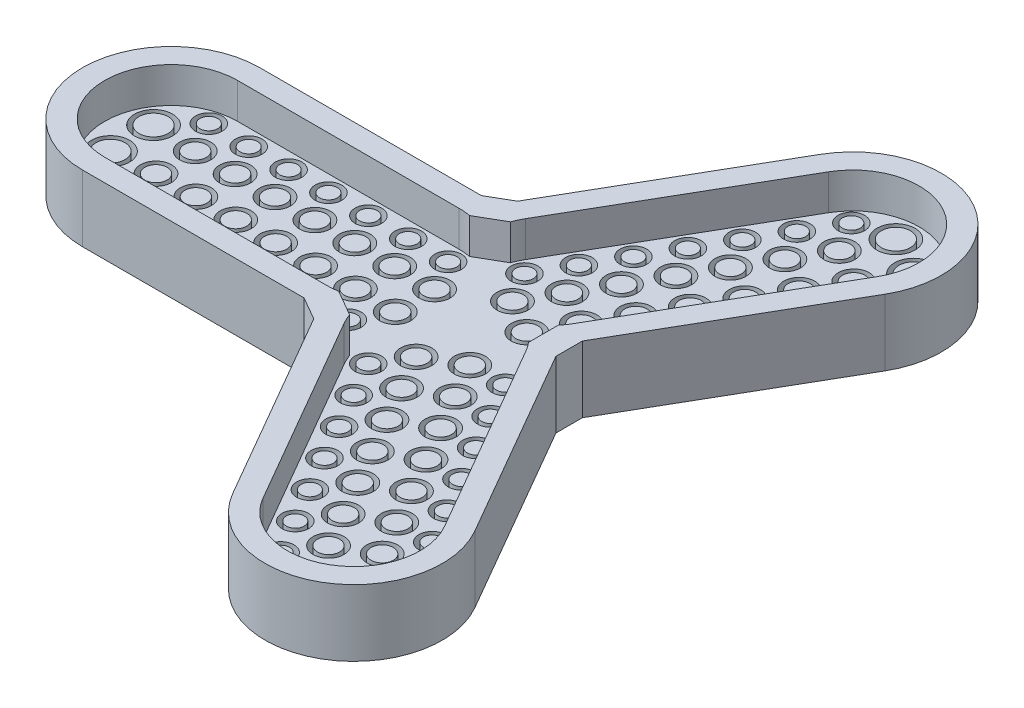
from build123d import *

# Parameters (mm, degrees)
BOSS_EXTRUDE1_DEPTH = 15
BOSS_EXTRUDE2_DEPTH = 7
SKETCH2_R           = 3.5
SKETCH2_R_2         = 2.5
SKETCH2_R_3         = 3
SKETCH2_R_4         = 2
SKETCH2_R_5         = 4.287290874
SKETCH2_R_6         = 3.287290874
CUT_EXTRUDE1_DEPTH  = 4


with BuildPart() as part:
    # Sketch1 → Boss-Extrude1 (new body)
    with BuildSketch(Plane(origin=(0, 0, 0), x_dir=(1, 0, 0), z_dir=(0, 1, 0))):
        with BuildLine():
            Line((-25, -20), (25, -20))
            Line((25, -20), (30.179491924, -22.990381057))
            Line((30.179491924, -22.990381057), (55.179491924, -66.291651246))
            ThreePointArc((55.179491924, -66.291651246), (82.5, -73.612159322), (89.820508076, -46.291651246))
            Line((89.820508076, -46.291651246), (64.820508076, -2.990381057))
            Line((64.820508076, -2.990381057), (64.820508076, 2.990381057))
            Line((64.820508076, 2.990381057), (89.820508076, 46.291651246))
            ThreePointArc((89.820508076, 46.291651246), (82.5, 73.612159322), (55.179491924, 66.291651246))
            Line((55.179491924, 66.291651246), (30.179491924, 22.990381057))
            Line((30.179491924, 22.990381057), (25, 20))
            Line((25, 20), (-25, 20))
            ThreePointArc((-25, 20), (-45, 0), (-25, -20))
        make_face()
        with BuildLine():
            ThreePointArc((-25, -15), (-40, 0), (-25, 15))
            Line((-25, 15), (25, 15))
            ThreePointArc((25, 15), (26.294788991, 14.944012897), (27.579912451, 14.776469529))
            Line((27.579912451, 14.776469529), (33.413245784, 18.144346099))
            ThreePointArc((33.413245784, 18.144346099), (33.910710701, 19.341067347), (34.509618943, 20.490381057))
            Line((34.509618943, 20.490381057), (59.509618943, 63.791651246))
            ThreePointArc((59.509618943, 63.791651246), (80, 69.282032303), (85.490381057, 48.791651246))
            Line((85.490381057, 48.791651246), (60.490381057, 5.490381057))
            ThreePointArc((60.490381057, 5.490381057), (59.794500308, 4.397054449), (59.006841765, 3.36787657))
            Line((59.006841765, 3.36787657), (59.006841765, -3.36787657))
            ThreePointArc((59.006841765, -3.36787657), (59.794500308, -4.397054449), (60.490381057, -5.490381057))
            Line((60.490381057, -5.490381057), (85.490381057, -48.791651246))
            ThreePointArc((85.490381057, -48.791651246), (80, -69.282032303), (59.509618943, -63.791651246))
            Line((59.509618943, -63.791651246), (34.509618943, -20.490381057))
            ThreePointArc((34.509618943, -20.490381057), (33.910710701, -19.341067347), (33.413245784, -18.144346099))
            Line((33.413245784, -18.144346099), (27.579912451, -14.776469529))
            ThreePointArc((27.579912451, -14.776469529), (26.294788991, -14.944012897), (25, -15))
            Line((25, -15), (-25, -15))
        make_face(mode=Mode.SUBTRACT)
    extrude(amount=BOSS_EXTRUDE1_DEPTH)

    # Sketch1<2> → Boss-Extrude2 (add)
    with BuildSketch(Plane(origin=(0, 0, 0), x_dir=(1, 0, 0), z_dir=(0, 1, 0))):
        with BuildLine():
            Line((25, 15), (-25, 15))
            ThreePointArc((-25, 15), (-40, 0), (-25, -15))
            Line((-25, -15), (25, -15))
            ThreePointArc((25, -15), (26.294788991, -14.944012897), (27.579912451, -14.776469529))
            Line((27.579912451, -14.776469529), (33.413245784, -18.144346099))
            ThreePointArc((33.413245784, -18.144346099), (33.910710701, -19.341067347), (34.509618943, -20.490381057))
            Line((34.509618943, -20.490381057), (59.509618943, -63.791651246))
            ThreePointArc((59.509618943, -63.791651246), (80, -69.282032303), (85.490381057, -48.791651246))
            Line((85.490381057, -48.791651246), (60.490381057, -5.490381057))
            ThreePointArc((60.490381057, -5.490381057), (59.794500308, -4.397054449), (59.006841765, -3.36787657))
            Line((59.006841765, -3.36787657), (59.006841765, 3.36787657))
            ThreePointArc((59.006841765, 3.36787657), (59.794500308, 4.397054449), (60.490381057, 5.490381057))
            Line((60.490381057, 5.490381057), (85.490381057, 48.791651246))
            ThreePointArc((85.490381057, 48.791651246), (80, 69.282032303), (59.509618943, 63.791651246))
            Line((59.509618943, 63.791651246), (34.509618943, 20.490381057))
            ThreePointArc((34.509618943, 20.490381057), (33.910710701, 19.341067347), (33.413245784, 18.144346099))
            Line((33.413245784, 18.144346099), (27.579912451, 14.776469529))
            ThreePointArc((27.579912451, 14.776469529), (26.294788991, 14.944012897), (25, 15))
        make_face()
    extrude(amount=BOSS_EXTRUDE2_DEPTH)

    # Sketch2 → Cut-Extrude1 (cut)
    # profile 1 of 90: a face of its own
    with BuildSketch(Plane(origin=(0, 7, 0), x_dir=(1, 0, 0), z_dir=(0, 1, 0))):
        with Locations((30.011797316, -4.431729837)):
            Circle(SKETCH2_R)
        with Locations((30.011797316, -4.431729837)):
            Circle(SKETCH2_R_2, mode=Mode.SUBTRACT)
    # profile 2 of 90: a face of its own
    with BuildSketch(Plane(origin=(0, 7, 0), x_dir=(1, 0, 0), z_dir=(0, 1, 0))):
        with Locations((21.011797316, -4.431729837)):
            Circle(SKETCH2_R)
        with Locations((21.011797316, -4.431729837)):
            Circle(SKETCH2_R_2, mode=Mode.SUBTRACT)
    # profile 3 of 90: a face of its own
    with BuildSketch(Plane(origin=(0, 7, 0), x_dir=(1, 0, 0), z_dir=(0, 1, 0))):
        with Locations((12.011797316, -4.431729837)):
            Circle(SKETCH2_R)
        with Locations((12.011797316, -4.431729837)):
            Circle(SKETCH2_R_2, mode=Mode.SUBTRACT)
    # profile 4 of 90: a face of its own
    with BuildSketch(Plane(origin=(0, 7, 0), x_dir=(1, 0, 0), z_dir=(0, 1, 0))):
        with Locations((3.011797316, -4.431729837)):
            Circle(SKETCH2_R)
        with Locations((3.011797316, -4.431729837)):
            Circle(SKETCH2_R_2, mode=Mode.SUBTRACT)
    # profile 5 of 90: a face of its own
    with BuildSketch(Plane(origin=(0, 7, 0), x_dir=(1, 0, 0), z_dir=(0, 1, 0))):
        with Locations((-5.988202684, -4.431729837)):
            Circle(SKETCH2_R)
        with Locations((-5.988202684, -4.431729837)):
            Circle(SKETCH2_R_2, mode=Mode.SUBTRACT)
    # profile 6 of 90: a face of its own
    with BuildSketch(Plane(origin=(0, 7, 0), x_dir=(1, 0, 0), z_dir=(0, 1, 0))):
        with Locations((-14.988202684, -4.431729837)):
            Circle(SKETCH2_R)
        with Locations((-14.988202684, -4.431729837)):
            Circle(SKETCH2_R_2, mode=Mode.SUBTRACT)
    # profile 7 of 90: a face of its own
    with BuildSketch(Plane(origin=(0, 7, 0), x_dir=(1, 0, 0), z_dir=(0, 1, 0))):
        with Locations((-27.809609086, -11.315014847)):
            Circle(SKETCH2_R_3)
        with Locations((-27.809609086, -11.315014847)):
            Circle(SKETCH2_R_4, mode=Mode.SUBTRACT)
    # profile 8 of 90: a face of its own
    with BuildSketch(Plane(origin=(0, 7, 0), x_dir=(1, 0, 0), z_dir=(0, 1, 0))):
        with Locations((-18.809609086, -11.315014847)):
            Circle(SKETCH2_R_3)
        with Locations((-18.809609086, -11.315014847)):
            Circle(SKETCH2_R_4, mode=Mode.SUBTRACT)
    # profile 9 of 90: a face of its own
    with BuildSketch(Plane(origin=(0, 7, 0), x_dir=(1, 0, 0), z_dir=(0, 1, 0))):
        with Locations((-9.809609086, -11.315014847)):
            Circle(SKETCH2_R_3)
        with Locations((-9.809609086, -11.315014847)):
            Circle(SKETCH2_R_4, mode=Mode.SUBTRACT)
    # profile 10 of 90: a face of its own
    with BuildSketch(Plane(origin=(0, 7, 0), x_dir=(1, 0, 0), z_dir=(0, 1, 0))):
        with Locations((-0.809609086, -11.315014847)):
            Circle(SKETCH2_R_3)
        with Locations((-0.809609086, -11.315014847)):
            Circle(SKETCH2_R_4, mode=Mode.SUBTRACT)
    # profile 11 of 90: a face of its own
    with BuildSketch(Plane(origin=(0, 7, 0), x_dir=(1, 0, 0), z_dir=(0, 1, 0))):
        with Locations((8.190390914, -11.315014847)):
            Circle(SKETCH2_R_3)
        with Locations((8.190390914, -11.315014847)):
            Circle(SKETCH2_R_4, mode=Mode.SUBTRACT)
    # profile 12 of 90: a face of its own
    with BuildSketch(Plane(origin=(0, 7, 0), x_dir=(1, 0, 0), z_dir=(0, 1, 0))):
        with Locations((17.190390914, -11.315014847)):
            Circle(SKETCH2_R_3)
        with Locations((17.190390914, -11.315014847)):
            Circle(SKETCH2_R_4, mode=Mode.SUBTRACT)
    # profile 13 of 90: a face of its own
    with BuildSketch(Plane(origin=(0, 7, 0), x_dir=(1, 0, 0), z_dir=(0, 1, 0))):
        with Locations((26.190390914, -11.315014847)):
            Circle(SKETCH2_R_3)
        with Locations((26.190390914, -11.315014847)):
            Circle(SKETCH2_R_4, mode=Mode.SUBTRACT)
    # profile 14 of 90: a face of its own
    with BuildSketch(Plane(origin=(0, 7, 0), x_dir=(1, 0, 0), z_dir=(0, 1, 0))):
        with Locations((-23.988202684, -4.431729837)):
            Circle(SKETCH2_R)
        with Locations((-23.988202684, -4.431729837)):
            Circle(SKETCH2_R_2, mode=Mode.SUBTRACT)
    # profile 15 of 90: a face of its own
    with BuildSketch(Plane(origin=(0, 7, 0), x_dir=(1, 0, 0), z_dir=(0, 1, 0))):
        with Locations((-23.988202684, 4.431729837)):
            Circle(SKETCH2_R)
        with Locations((-23.988202684, 4.431729837)):
            Circle(SKETCH2_R_2, mode=Mode.SUBTRACT)
    # profile 16 of 90: a face of its own
    with BuildSketch(Plane(origin=(0, 7, 0), x_dir=(1, 0, 0), z_dir=(0, 1, 0))):
        with Locations((-14.988202684, 4.431729837)):
            Circle(SKETCH2_R)
        with Locations((-14.988202684, 4.431729837)):
            Circle(SKETCH2_R_2, mode=Mode.SUBTRACT)
    # profile 17 of 90: a face of its own
    with BuildSketch(Plane(origin=(0, 7, 0), x_dir=(1, 0, 0), z_dir=(0, 1, 0))):
        with Locations((-5.988202684, 4.431729837)):
            Circle(SKETCH2_R)
        with Locations((-5.988202684, 4.431729837)):
            Circle(SKETCH2_R_2, mode=Mode.SUBTRACT)
    # profile 18 of 90: a face of its own
    with BuildSketch(Plane(origin=(0, 7, 0), x_dir=(1, 0, 0), z_dir=(0, 1, 0))):
        with Locations((3.011797316, 4.431729837)):
            Circle(SKETCH2_R)
        with Locations((3.011797316, 4.431729837)):
            Circle(SKETCH2_R_2, mode=Mode.SUBTRACT)
    # profile 19 of 90: a face of its own
    with BuildSketch(Plane(origin=(0, 7, 0), x_dir=(1, 0, 0), z_dir=(0, 1, 0))):
        with Locations((12.011797316, 4.431729837)):
            Circle(SKETCH2_R)
        with Locations((12.011797316, 4.431729837)):
            Circle(SKETCH2_R_2, mode=Mode.SUBTRACT)
    # profile 20 of 90: a face of its own
    with BuildSketch(Plane(origin=(0, 7, 0), x_dir=(1, 0, 0), z_dir=(0, 1, 0))):
        with Locations((21.011797316, 4.431729837)):
            Circle(SKETCH2_R)
        with Locations((21.011797316, 4.431729837)):
            Circle(SKETCH2_R_2, mode=Mode.SUBTRACT)
    # profile 21 of 90: a face of its own
    with BuildSketch(Plane(origin=(0, 7, 0), x_dir=(1, 0, 0), z_dir=(0, 1, 0))):
        with Locations((30.011797316, 4.431729837)):
            Circle(SKETCH2_R)
        with Locations((30.011797316, 4.431729837)):
            Circle(SKETCH2_R_2, mode=Mode.SUBTRACT)
    # profile 22 of 90: a face of its own
    with BuildSketch(Plane(origin=(0, 7, 0), x_dir=(1, 0, 0), z_dir=(0, 1, 0))):
        with Locations((26.190390914, 11.315014847)):
            Circle(SKETCH2_R_3)
        with Locations((26.190390914, 11.315014847)):
            Circle(SKETCH2_R_4, mode=Mode.SUBTRACT)
    # profile 23 of 90: a face of its own
    with BuildSketch(Plane(origin=(0, 7, 0), x_dir=(1, 0, 0), z_dir=(0, 1, 0))):
        with Locations((17.190390914, 11.315014847)):
            Circle(SKETCH2_R_3)
        with Locations((17.190390914, 11.315014847)):
            Circle(SKETCH2_R_4, mode=Mode.SUBTRACT)
    # profile 24 of 90: a face of its own
    with BuildSketch(Plane(origin=(0, 7, 0), x_dir=(1, 0, 0), z_dir=(0, 1, 0))):
        with Locations((8.190390914, 11.315014847)):
            Circle(SKETCH2_R_3)
        with Locations((8.190390914, 11.315014847)):
            Circle(SKETCH2_R_4, mode=Mode.SUBTRACT)
    # profile 25 of 90: a face of its own
    with BuildSketch(Plane(origin=(0, 7, 0), x_dir=(1, 0, 0), z_dir=(0, 1, 0))):
        with Locations((-0.809609086, 11.315014847)):
            Circle(SKETCH2_R_3)
        with Locations((-0.809609086, 11.315014847)):
            Circle(SKETCH2_R_4, mode=Mode.SUBTRACT)
    # profile 26 of 90: a face of its own
    with BuildSketch(Plane(origin=(0, 7, 0), x_dir=(1, 0, 0), z_dir=(0, 1, 0))):
        with Locations((-9.809609086, 11.315014847)):
            Circle(SKETCH2_R_3)
        with Locations((-9.809609086, 11.315014847)):
            Circle(SKETCH2_R_4, mode=Mode.SUBTRACT)
    # profile 27 of 90: a face of its own
    with BuildSketch(Plane(origin=(0, 7, 0), x_dir=(1, 0, 0), z_dir=(0, 1, 0))):
        with Locations((-18.809609086, 11.315014847)):
            Circle(SKETCH2_R_3)
        with Locations((-18.809609086, 11.315014847)):
            Circle(SKETCH2_R_4, mode=Mode.SUBTRACT)
    # profile 28 of 90: a face of its own
    with BuildSketch(Plane(origin=(0, 7, 0), x_dir=(1, 0, 0), z_dir=(0, 1, 0))):
        with Locations((-27.809609086, 11.315014847)):
            Circle(SKETCH2_R_3)
        with Locations((-27.809609086, 11.315014847)):
            Circle(SKETCH2_R_4, mode=Mode.SUBTRACT)
    # profile 29 of 90: a face of its own
    with BuildSketch(Plane(origin=(0, 7, 0), x_dir=(1, 0, 0), z_dir=(0, 1, 0))):
        with Locations((-33.519550932, -5.159053716)):
            Circle(SKETCH2_R_5)
        with Locations((-33.519550932, -5.159053716)):
            Circle(SKETCH2_R_6, mode=Mode.SUBTRACT)
    # profile 30 of 90: a face of its own
    with BuildSketch(Plane(origin=(0, 7, 0), x_dir=(1, 0, 0), z_dir=(0, 1, 0))):
        with Locations((-33.764843827, 4.799837797)):
            Circle(SKETCH2_R_5)
        with Locations((-33.764843827, 4.799837797)):
            Circle(SKETCH2_R_6, mode=Mode.SUBTRACT)
    # profile 31 of 90: a face of its own
    with BuildSketch(Plane(origin=(0, 7, 0), x_dir=(1, 0, 0), z_dir=(0, 1, 0))):
        with Locations((41.156110721, 10.865902181)):
            Circle(SKETCH2_R)
        with Locations((41.156110721, 10.865902181)):
            Circle(SKETCH2_R_2, mode=Mode.SUBTRACT)
    # profile 32 of 90: a face of its own
    with BuildSketch(Plane(origin=(0, 7, 0), x_dir=(1, 0, 0), z_dir=(0, 1, 0))):
        with Locations((45.656110721, 18.660130815)):
            Circle(SKETCH2_R)
        with Locations((45.656110721, 18.660130815)):
            Circle(SKETCH2_R_2, mode=Mode.SUBTRACT)
    # profile 33 of 90: a face of its own
    with BuildSketch(Plane(origin=(0, 7, 0), x_dir=(1, 0, 0), z_dir=(0, 1, 0))):
        with Locations((50.156110721, 26.454359449)):
            Circle(SKETCH2_R)
        with Locations((50.156110721, 26.454359449)):
            Circle(SKETCH2_R_2, mode=Mode.SUBTRACT)
    # profile 34 of 90: a face of its own
    with BuildSketch(Plane(origin=(0, 7, 0), x_dir=(1, 0, 0), z_dir=(0, 1, 0))):
        with Locations((54.656110721, 34.248588083)):
            Circle(SKETCH2_R)
        with Locations((54.656110721, 34.248588083)):
            Circle(SKETCH2_R_2, mode=Mode.SUBTRACT)
    # profile 35 of 90: a face of its own
    with BuildSketch(Plane(origin=(0, 7, 0), x_dir=(1, 0, 0), z_dir=(0, 1, 0))):
        with Locations((59.156110721, 42.042816717)):
            Circle(SKETCH2_R)
        with Locations((59.156110721, 42.042816717)):
            Circle(SKETCH2_R_2, mode=Mode.SUBTRACT)
    # profile 36 of 90: a face of its own
    with BuildSketch(Plane(origin=(0, 7, 0), x_dir=(1, 0, 0), z_dir=(0, 1, 0))):
        with Locations((63.656110721, 49.837045351)):
            Circle(SKETCH2_R)
        with Locations((63.656110721, 49.837045351)):
            Circle(SKETCH2_R_2, mode=Mode.SUBTRACT)
    # profile 37 of 90: a face of its own
    with BuildSketch(Plane(origin=(0, 7, 0), x_dir=(1, 0, 0), z_dir=(0, 1, 0))):
        with Locations((64.105714242, 64.382351513)):
            Circle(SKETCH2_R_3)
        with Locations((64.105714242, 64.382351513)):
            Circle(SKETCH2_R_4, mode=Mode.SUBTRACT)
    # profile 38 of 90: a face of its own
    with BuildSketch(Plane(origin=(0, 7, 0), x_dir=(1, 0, 0), z_dir=(0, 1, 0))):
        with Locations((59.605714242, 56.588122879)):
            Circle(SKETCH2_R_3)
        with Locations((59.605714242, 56.588122879)):
            Circle(SKETCH2_R_4, mode=Mode.SUBTRACT)
    # profile 39 of 90: a face of its own
    with BuildSketch(Plane(origin=(0, 7, 0), x_dir=(1, 0, 0), z_dir=(0, 1, 0))):
        with Locations((55.105714242, 48.793894244)):
            Circle(SKETCH2_R_3)
        with Locations((55.105714242, 48.793894244)):
            Circle(SKETCH2_R_4, mode=Mode.SUBTRACT)
    # profile 40 of 90: a face of its own
    with BuildSketch(Plane(origin=(0, 7, 0), x_dir=(1, 0, 0), z_dir=(0, 1, 0))):
        with Locations((50.605714242, 40.99966561)):
            Circle(SKETCH2_R_3)
        with Locations((50.605714242, 40.99966561)):
            Circle(SKETCH2_R_4, mode=Mode.SUBTRACT)
    # profile 41 of 90: a face of its own
    with BuildSketch(Plane(origin=(0, 7, 0), x_dir=(1, 0, 0), z_dir=(0, 1, 0))):
        with Locations((46.105714242, 33.205436976)):
            Circle(SKETCH2_R_3)
        with Locations((46.105714242, 33.205436976)):
            Circle(SKETCH2_R_4, mode=Mode.SUBTRACT)
    # profile 42 of 90: a face of its own
    with BuildSketch(Plane(origin=(0, 7, 0), x_dir=(1, 0, 0), z_dir=(0, 1, 0))):
        with Locations((41.605714242, 25.411208342)):
            Circle(SKETCH2_R_3)
        with Locations((41.605714242, 25.411208342)):
            Circle(SKETCH2_R_4, mode=Mode.SUBTRACT)
    # profile 43 of 90: a face of its own
    with BuildSketch(Plane(origin=(0, 7, 0), x_dir=(1, 0, 0), z_dir=(0, 1, 0))):
        with Locations((37.105714242, 17.616979708)):
            Circle(SKETCH2_R_3)
        with Locations((37.105714242, 17.616979708)):
            Circle(SKETCH2_R_4, mode=Mode.SUBTRACT)
    # profile 44 of 90: a face of its own
    with BuildSketch(Plane(origin=(0, 7, 0), x_dir=(1, 0, 0), z_dir=(0, 1, 0))):
        with Locations((68.156110721, 57.631273985)):
            Circle(SKETCH2_R)
        with Locations((68.156110721, 57.631273985)):
            Circle(SKETCH2_R_2, mode=Mode.SUBTRACT)
    # profile 45 of 90: a face of its own
    with BuildSketch(Plane(origin=(0, 7, 0), x_dir=(1, 0, 0), z_dir=(0, 1, 0))):
        with Locations((75.832091963, 53.199544149)):
            Circle(SKETCH2_R)
        with Locations((75.832091963, 53.199544149)):
            Circle(SKETCH2_R_2, mode=Mode.SUBTRACT)
    # profile 46 of 90: a face of its own
    with BuildSketch(Plane(origin=(0, 7, 0), x_dir=(1, 0, 0), z_dir=(0, 1, 0))):
        with Locations((71.332091963, 45.405315515)):
            Circle(SKETCH2_R)
        with Locations((71.332091963, 45.405315515)):
            Circle(SKETCH2_R_2, mode=Mode.SUBTRACT)
    # profile 47 of 90: a face of its own
    with BuildSketch(Plane(origin=(0, 7, 0), x_dir=(1, 0, 0), z_dir=(0, 1, 0))):
        with Locations((66.832091963, 37.611086881)):
            Circle(SKETCH2_R)
        with Locations((66.832091963, 37.611086881)):
            Circle(SKETCH2_R_2, mode=Mode.SUBTRACT)
    # profile 48 of 90: a face of its own
    with BuildSketch(Plane(origin=(0, 7, 0), x_dir=(1, 0, 0), z_dir=(0, 1, 0))):
        with Locations((62.332091963, 29.816858246)):
            Circle(SKETCH2_R)
        with Locations((62.332091963, 29.816858246)):
            Circle(SKETCH2_R_2, mode=Mode.SUBTRACT)
    # profile 49 of 90: a face of its own
    with BuildSketch(Plane(origin=(0, 7, 0), x_dir=(1, 0, 0), z_dir=(0, 1, 0))):
        with Locations((57.832091963, 22.022629612)):
            Circle(SKETCH2_R)
        with Locations((57.832091963, 22.022629612)):
            Circle(SKETCH2_R_2, mode=Mode.SUBTRACT)
    # profile 50 of 90: a face of its own
    with BuildSketch(Plane(origin=(0, 7, 0), x_dir=(1, 0, 0), z_dir=(0, 1, 0))):
        with Locations((53.332091963, 14.228400978)):
            Circle(SKETCH2_R)
        with Locations((53.332091963, 14.228400978)):
            Circle(SKETCH2_R_2, mode=Mode.SUBTRACT)
    # profile 51 of 90: a face of its own
    with BuildSketch(Plane(origin=(0, 7, 0), x_dir=(1, 0, 0), z_dir=(0, 1, 0))):
        with Locations((48.832091963, 6.434172344)):
            Circle(SKETCH2_R)
        with Locations((48.832091963, 6.434172344)):
            Circle(SKETCH2_R_2, mode=Mode.SUBTRACT)
    # profile 52 of 90: a face of its own
    with BuildSketch(Plane(origin=(0, 7, 0), x_dir=(1, 0, 0), z_dir=(0, 1, 0))):
        with Locations((56.703894844, 6.301964862)):
            Circle(SKETCH2_R_3)
        with Locations((56.703894844, 6.301964862)):
            Circle(SKETCH2_R_4, mode=Mode.SUBTRACT)
    # profile 53 of 90: a face of its own
    with BuildSketch(Plane(origin=(0, 7, 0), x_dir=(1, 0, 0), z_dir=(0, 1, 0))):
        with Locations((61.203894844, 14.096193496)):
            Circle(SKETCH2_R_3)
        with Locations((61.203894844, 14.096193496)):
            Circle(SKETCH2_R_4, mode=Mode.SUBTRACT)
    # profile 54 of 90: a face of its own
    with BuildSketch(Plane(origin=(0, 7, 0), x_dir=(1, 0, 0), z_dir=(0, 1, 0))):
        with Locations((65.703894844, 21.89042213)):
            Circle(SKETCH2_R_3)
        with Locations((65.703894844, 21.89042213)):
            Circle(SKETCH2_R_4, mode=Mode.SUBTRACT)
    # profile 55 of 90: a face of its own
    with BuildSketch(Plane(origin=(0, 7, 0), x_dir=(1, 0, 0), z_dir=(0, 1, 0))):
        with Locations((70.203894844, 29.684650764)):
            Circle(SKETCH2_R_3)
        with Locations((70.203894844, 29.684650764)):
            Circle(SKETCH2_R_4, mode=Mode.SUBTRACT)
    # profile 56 of 90: a face of its own
    with BuildSketch(Plane(origin=(0, 7, 0), x_dir=(1, 0, 0), z_dir=(0, 1, 0))):
        with Locations((74.703894844, 37.478879398)):
            Circle(SKETCH2_R_3)
        with Locations((74.703894844, 37.478879398)):
            Circle(SKETCH2_R_4, mode=Mode.SUBTRACT)
    # profile 57 of 90: a face of its own
    with BuildSketch(Plane(origin=(0, 7, 0), x_dir=(1, 0, 0), z_dir=(0, 1, 0))):
        with Locations((79.203894844, 45.273108032)):
            Circle(SKETCH2_R_3)
        with Locations((79.203894844, 45.273108032)):
            Circle(SKETCH2_R_4, mode=Mode.SUBTRACT)
    # profile 58 of 90: a face of its own
    with BuildSketch(Plane(origin=(0, 7, 0), x_dir=(1, 0, 0), z_dir=(0, 1, 0))):
        with Locations((83.703894844, 53.067336666)):
            Circle(SKETCH2_R_3)
        with Locations((83.703894844, 53.067336666)):
            Circle(SKETCH2_R_4, mode=Mode.SUBTRACT)
    # profile 59 of 90: a face of its own
    with BuildSketch(Plane(origin=(0, 7, 0), x_dir=(1, 0, 0), z_dir=(0, 1, 0))):
        with Locations((72.291903889, 66.24932564)):
            Circle(SKETCH2_R_5)
        with Locations((72.291903889, 66.24932564)):
            Circle(SKETCH2_R_6, mode=Mode.SUBTRACT)
    # profile 60 of 90: a face of its own
    with BuildSketch(Plane(origin=(0, 7, 0), x_dir=(1, 0, 0), z_dir=(0, 1, 0))):
        with Locations((81.03920338, 61.482309762)):
            Circle(SKETCH2_R_5)
        with Locations((81.03920338, 61.482309762)):
            Circle(SKETCH2_R_6, mode=Mode.SUBTRACT)
    # profile 61 of 90: a face of its own
    with BuildSketch(Plane(origin=(0, 7, 0), x_dir=(1, 0, 0), z_dir=(0, 1, 0))):
        with Locations((48.832091963, -6.434172344)):
            Circle(SKETCH2_R)
        with Locations((48.832091963, -6.434172344)):
            Circle(SKETCH2_R_2, mode=Mode.SUBTRACT)
    # profile 62 of 90: a face of its own
    with BuildSketch(Plane(origin=(0, 7, 0), x_dir=(1, 0, 0), z_dir=(0, 1, 0))):
        with Locations((53.332091963, -14.228400978)):
            Circle(SKETCH2_R)
        with Locations((53.332091963, -14.228400978)):
            Circle(SKETCH2_R_2, mode=Mode.SUBTRACT)
    # profile 63 of 90: a face of its own
    with BuildSketch(Plane(origin=(0, 7, 0), x_dir=(1, 0, 0), z_dir=(0, 1, 0))):
        with Locations((57.832091963, -22.022629612)):
            Circle(SKETCH2_R)
        with Locations((57.832091963, -22.022629612)):
            Circle(SKETCH2_R_2, mode=Mode.SUBTRACT)
    # profile 64 of 90: a face of its own
    with BuildSketch(Plane(origin=(0, 7, 0), x_dir=(1, 0, 0), z_dir=(0, 1, 0))):
        with Locations((62.332091963, -29.816858246)):
            Circle(SKETCH2_R)
        with Locations((62.332091963, -29.816858246)):
            Circle(SKETCH2_R_2, mode=Mode.SUBTRACT)
    # profile 65 of 90: a face of its own
    with BuildSketch(Plane(origin=(0, 7, 0), x_dir=(1, 0, 0), z_dir=(0, 1, 0))):
        with Locations((66.832091963, -37.611086881)):
            Circle(SKETCH2_R)
        with Locations((66.832091963, -37.611086881)):
            Circle(SKETCH2_R_2, mode=Mode.SUBTRACT)
    # profile 66 of 90: a face of its own
    with BuildSketch(Plane(origin=(0, 7, 0), x_dir=(1, 0, 0), z_dir=(0, 1, 0))):
        with Locations((71.332091963, -45.405315515)):
            Circle(SKETCH2_R)
        with Locations((71.332091963, -45.405315515)):
            Circle(SKETCH2_R_2, mode=Mode.SUBTRACT)
    # profile 67 of 90: a face of its own
    with BuildSketch(Plane(origin=(0, 7, 0), x_dir=(1, 0, 0), z_dir=(0, 1, 0))):
        with Locations((83.703894844, -53.067336666)):
            Circle(SKETCH2_R_3)
        with Locations((83.703894844, -53.067336666)):
            Circle(SKETCH2_R_4, mode=Mode.SUBTRACT)
    # profile 68 of 90: a face of its own
    with BuildSketch(Plane(origin=(0, 7, 0), x_dir=(1, 0, 0), z_dir=(0, 1, 0))):
        with Locations((79.203894844, -45.273108032)):
            Circle(SKETCH2_R_3)
        with Locations((79.203894844, -45.273108032)):
            Circle(SKETCH2_R_4, mode=Mode.SUBTRACT)
    # profile 69 of 90: a face of its own
    with BuildSketch(Plane(origin=(0, 7, 0), x_dir=(1, 0, 0), z_dir=(0, 1, 0))):
        with Locations((74.703894844, -37.478879398)):
            Circle(SKETCH2_R_3)
        with Locations((74.703894844, -37.478879398)):
            Circle(SKETCH2_R_4, mode=Mode.SUBTRACT)
    # profile 70 of 90: a face of its own
    with BuildSketch(Plane(origin=(0, 7, 0), x_dir=(1, 0, 0), z_dir=(0, 1, 0))):
        with Locations((70.203894844, -29.684650764)):
            Circle(SKETCH2_R_3)
        with Locations((70.203894844, -29.684650764)):
            Circle(SKETCH2_R_4, mode=Mode.SUBTRACT)
    # profile 71 of 90: a face of its own
    with BuildSketch(Plane(origin=(0, 7, 0), x_dir=(1, 0, 0), z_dir=(0, 1, 0))):
        with Locations((65.703894844, -21.89042213)):
            Circle(SKETCH2_R_3)
        with Locations((65.703894844, -21.89042213)):
            Circle(SKETCH2_R_4, mode=Mode.SUBTRACT)
    # profile 72 of 90: a face of its own
    with BuildSketch(Plane(origin=(0, 7, 0), x_dir=(1, 0, 0), z_dir=(0, 1, 0))):
        with Locations((61.203894844, -14.096193496)):
            Circle(SKETCH2_R_3)
        with Locations((61.203894844, -14.096193496)):
            Circle(SKETCH2_R_4, mode=Mode.SUBTRACT)
    # profile 73 of 90: a face of its own
    with BuildSketch(Plane(origin=(0, 7, 0), x_dir=(1, 0, 0), z_dir=(0, 1, 0))):
        with Locations((56.703894844, -6.301964862)):
            Circle(SKETCH2_R_3)
        with Locations((56.703894844, -6.301964862)):
            Circle(SKETCH2_R_4, mode=Mode.SUBTRACT)
    # profile 74 of 90: a face of its own
    with BuildSketch(Plane(origin=(0, 7, 0), x_dir=(1, 0, 0), z_dir=(0, 1, 0))):
        with Locations((75.832091963, -53.199544149)):
            Circle(SKETCH2_R)
        with Locations((75.832091963, -53.199544149)):
            Circle(SKETCH2_R_2, mode=Mode.SUBTRACT)
    # profile 75 of 90: a face of its own
    with BuildSketch(Plane(origin=(0, 7, 0), x_dir=(1, 0, 0), z_dir=(0, 1, 0))):
        with Locations((68.156110721, -57.631273985)):
            Circle(SKETCH2_R)
        with Locations((68.156110721, -57.631273985)):
            Circle(SKETCH2_R_2, mode=Mode.SUBTRACT)
    # profile 76 of 90: a face of its own
    with BuildSketch(Plane(origin=(0, 7, 0), x_dir=(1, 0, 0), z_dir=(0, 1, 0))):
        with Locations((63.656110721, -49.837045351)):
            Circle(SKETCH2_R)
        with Locations((63.656110721, -49.837045351)):
            Circle(SKETCH2_R_2, mode=Mode.SUBTRACT)
    # profile 77 of 90: a face of its own
    with BuildSketch(Plane(origin=(0, 7, 0), x_dir=(1, 0, 0), z_dir=(0, 1, 0))):
        with Locations((59.156110721, -42.042816717)):
            Circle(SKETCH2_R)
        with Locations((59.156110721, -42.042816717)):
            Circle(SKETCH2_R_2, mode=Mode.SUBTRACT)
    # profile 78 of 90: a face of its own
    with BuildSketch(Plane(origin=(0, 7, 0), x_dir=(1, 0, 0), z_dir=(0, 1, 0))):
        with Locations((54.656110721, -34.248588083)):
            Circle(SKETCH2_R)
        with Locations((54.656110721, -34.248588083)):
            Circle(SKETCH2_R_2, mode=Mode.SUBTRACT)
    # profile 79 of 90: a face of its own
    with BuildSketch(Plane(origin=(0, 7, 0), x_dir=(1, 0, 0), z_dir=(0, 1, 0))):
        with Locations((50.156110721, -26.454359449)):
            Circle(SKETCH2_R)
        with Locations((50.156110721, -26.454359449)):
            Circle(SKETCH2_R_2, mode=Mode.SUBTRACT)
    # profile 80 of 90: a face of its own
    with BuildSketch(Plane(origin=(0, 7, 0), x_dir=(1, 0, 0), z_dir=(0, 1, 0))):
        with Locations((45.656110721, -18.660130815)):
            Circle(SKETCH2_R)
        with Locations((45.656110721, -18.660130815)):
            Circle(SKETCH2_R_2, mode=Mode.SUBTRACT)
    # profile 81 of 90: a face of its own
    with BuildSketch(Plane(origin=(0, 7, 0), x_dir=(1, 0, 0), z_dir=(0, 1, 0))):
        with Locations((41.156110721, -10.865902181)):
            Circle(SKETCH2_R)
        with Locations((41.156110721, -10.865902181)):
            Circle(SKETCH2_R_2, mode=Mode.SUBTRACT)
    # profile 82 of 90: a face of its own
    with BuildSketch(Plane(origin=(0, 7, 0), x_dir=(1, 0, 0), z_dir=(0, 1, 0))):
        with Locations((37.105714242, -17.616979708)):
            Circle(SKETCH2_R_3)
        with Locations((37.105714242, -17.616979708)):
            Circle(SKETCH2_R_4, mode=Mode.SUBTRACT)
    # profile 83 of 90: a face of its own
    with BuildSketch(Plane(origin=(0, 7, 0), x_dir=(1, 0, 0), z_dir=(0, 1, 0))):
        with Locations((41.605714242, -25.411208342)):
            Circle(SKETCH2_R_3)
        with Locations((41.605714242, -25.411208342)):
            Circle(SKETCH2_R_4, mode=Mode.SUBTRACT)
    # profile 84 of 90: a face of its own
    with BuildSketch(Plane(origin=(0, 7, 0), x_dir=(1, 0, 0), z_dir=(0, 1, 0))):
        with Locations((46.105714242, -33.205436976)):
            Circle(SKETCH2_R_3)
        with Locations((46.105714242, -33.205436976)):
            Circle(SKETCH2_R_4, mode=Mode.SUBTRACT)
    # profile 85 of 90: a face of its own
    with BuildSketch(Plane(origin=(0, 7, 0), x_dir=(1, 0, 0), z_dir=(0, 1, 0))):
        with Locations((50.605714242, -40.99966561)):
            Circle(SKETCH2_R_3)
        with Locations((50.605714242, -40.99966561)):
            Circle(SKETCH2_R_4, mode=Mode.SUBTRACT)
    # profile 86 of 90: a face of its own
    with BuildSketch(Plane(origin=(0, 7, 0), x_dir=(1, 0, 0), z_dir=(0, 1, 0))):
        with Locations((55.105714242, -48.793894244)):
            Circle(SKETCH2_R_3)
        with Locations((55.105714242, -48.793894244)):
            Circle(SKETCH2_R_4, mode=Mode.SUBTRACT)
    # profile 87 of 90: a face of its own
    with BuildSketch(Plane(origin=(0, 7, 0), x_dir=(1, 0, 0), z_dir=(0, 1, 0))):
        with Locations((59.605714242, -56.588122879)):
            Circle(SKETCH2_R_3)
        with Locations((59.605714242, -56.588122879)):
            Circle(SKETCH2_R_4, mode=Mode.SUBTRACT)
    # profile 88 of 90: a face of its own
    with BuildSketch(Plane(origin=(0, 7, 0), x_dir=(1, 0, 0), z_dir=(0, 1, 0))):
        with Locations((64.105714242, -64.382351513)):
            Circle(SKETCH2_R_3)
        with Locations((64.105714242, -64.382351513)):
            Circle(SKETCH2_R_4, mode=Mode.SUBTRACT)
    # profile 89 of 90: a face of its own
    with BuildSketch(Plane(origin=(0, 7, 0), x_dir=(1, 0, 0), z_dir=(0, 1, 0))):
        with Locations((81.227647044, -61.090271924)):
            Circle(SKETCH2_R_5)
        with Locations((81.227647044, -61.090271924)):
            Circle(SKETCH2_R_6, mode=Mode.SUBTRACT)
    # profile 90 of 90: a face of its own
    with BuildSketch(Plane(origin=(0, 7, 0), x_dir=(1, 0, 0), z_dir=(0, 1, 0))):
        with Locations((72.725640447, -66.282147559)):
            Circle(SKETCH2_R_5)
        with Locations((72.725640447, -66.282147559)):
            Circle(SKETCH2_R_6, mode=Mode.SUBTRACT)
    extrude(amount=-CUT_EXTRUDE1_DEPTH, mode=Mode.SUBTRACT)


solid = part.part
